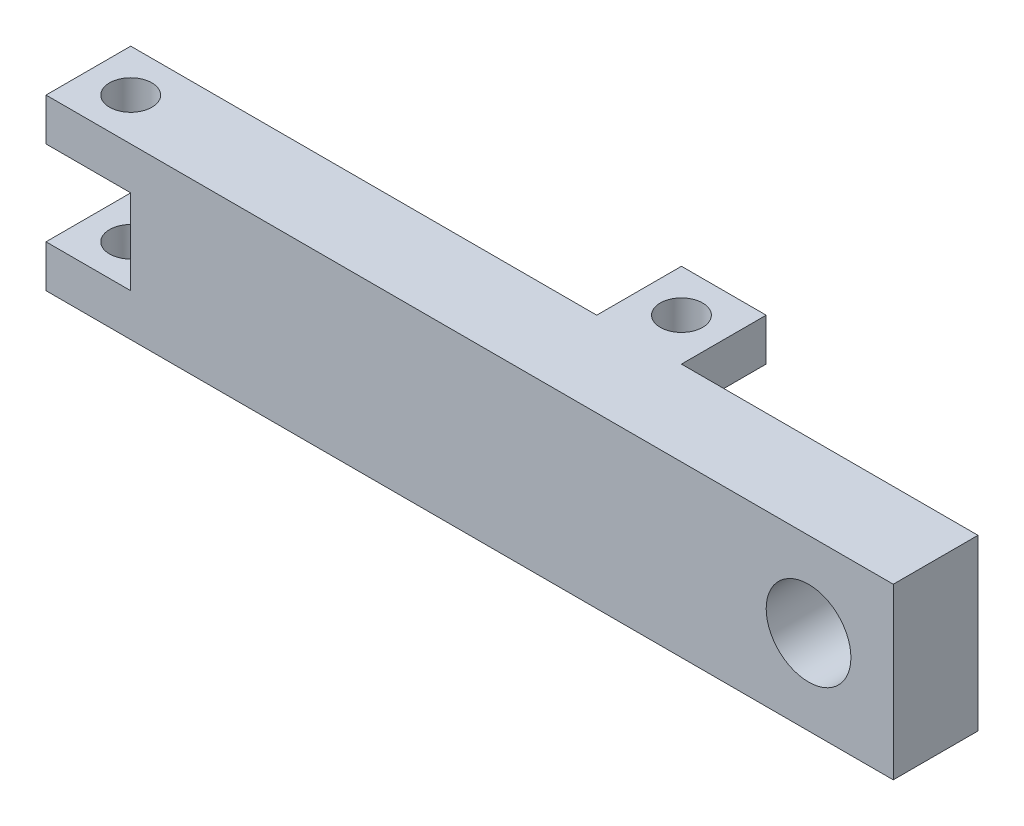
from build123d import *

# Parameters (mm, degrees)
SKETCH1_W           = 100
SKETCH1_H           = 10
SKETCH1_R           = 2.5
SKETCH1_W_2         = 10
BOSS_EXTRUDE1_DEPTH = 20
SKETCH2_W           = 10
SKETCH2_H           = 10
CUT_EXTRUDE1_DEPTH  = 10
SKETCH5_W           = 10
SKETCH5_H           = 10
CUT_EXTRUDE4_DEPTH  = 10
CUT_EXTRUDE3_REACH  = 66.031
SKETCH4_R           = 5


with BuildPart() as part:
    # Sketch1 → Boss-Extrude1 (new body)
    # profile 1 of 2: a face of its own
    with BuildSketch(Plane(origin=(0, 0, 0), x_dir=(1, 0, 0), z_dir=(0, 1, 0))):
        with Locations((-10, 0)):
            Rectangle(SKETCH1_W, SKETCH1_H)
        with Locations(Location((-55, 0, 0), (0, 0, 270))):
            Circle(SKETCH1_R, mode=Mode.SUBTRACT)
    # profile 2 of 2: a face of its own
    with BuildSketch(Plane(origin=(0, 0, 0), x_dir=(1, 0, 0), z_dir=(0, 1, 0))):
        with Locations((0, 10)):
            Rectangle(SKETCH1_W_2, SKETCH1_H)
        with Locations(Location((0, 10, 0), (0, 0, 270))):
            Circle(SKETCH1_R, mode=Mode.SUBTRACT)
    extrude(amount=-BOSS_EXTRUDE1_DEPTH)

    # Sketch2 → Cut-Extrude1 (cut)
    with BuildSketch(Plane.ZY.offset(60)):
        with Locations((0, -10)):
            Rectangle(SKETCH2_W, SKETCH2_H)
    extrude(amount=-CUT_EXTRUDE1_DEPTH, mode=Mode.SUBTRACT)

    # Sketch5 → Cut-Extrude4 (cut)
    with BuildSketch(Plane(origin=(0, 0, -15), x_dir=(-1, 0, 0), z_dir=(0, 0, -1))):
        with Locations((0, -10)):
            Rectangle(SKETCH5_W, SKETCH5_H)
    extrude(amount=-CUT_EXTRUDE4_DEPTH, mode=Mode.SUBTRACT)

    # Sketch4 → Cut-Extrude3 (cut, up to next)
    with BuildSketch(Plane(origin=(0, 0, -5), x_dir=(-1, 0, 0), z_dir=(0, 0, -1)), mode=Mode.PRIVATE) as cut_extrude3_sk1:
        with Locations((-30, -10)):
            Circle(SKETCH4_R)
    cut_extrude3_tool1 = extrude(cut_extrude3_sk1.sketch, amount=-CUT_EXTRUDE3_REACH, mode=Mode.PRIVATE) & part.part
    add(cut_extrude3_tool1.solids().sort_by_distance((30, -10, -5))[0], mode=Mode.SUBTRACT)


solid = part.part
